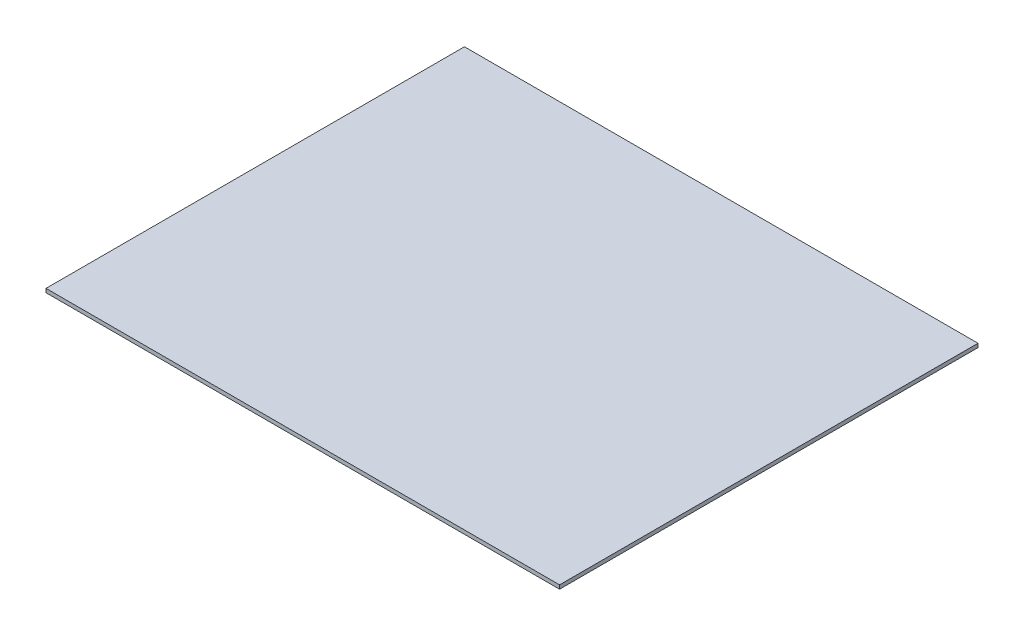
from build123d import *

# Parameters (mm, degrees)
SKETCH1_W           = 2700
SKETCH1_H           = 2200
BOSS_EXTRUDE1_DEPTH = 20


with BuildPart() as part:
    # Sketch1 → Boss-Extrude1 (new body)
    with BuildSketch(Plane(origin=(0, 0, 0), x_dir=(1, 0, 0), z_dir=(0, 1, 0))):
        Rectangle(SKETCH1_W, SKETCH1_H)
    extrude(amount=BOSS_EXTRUDE1_DEPTH)


solid = part.part
